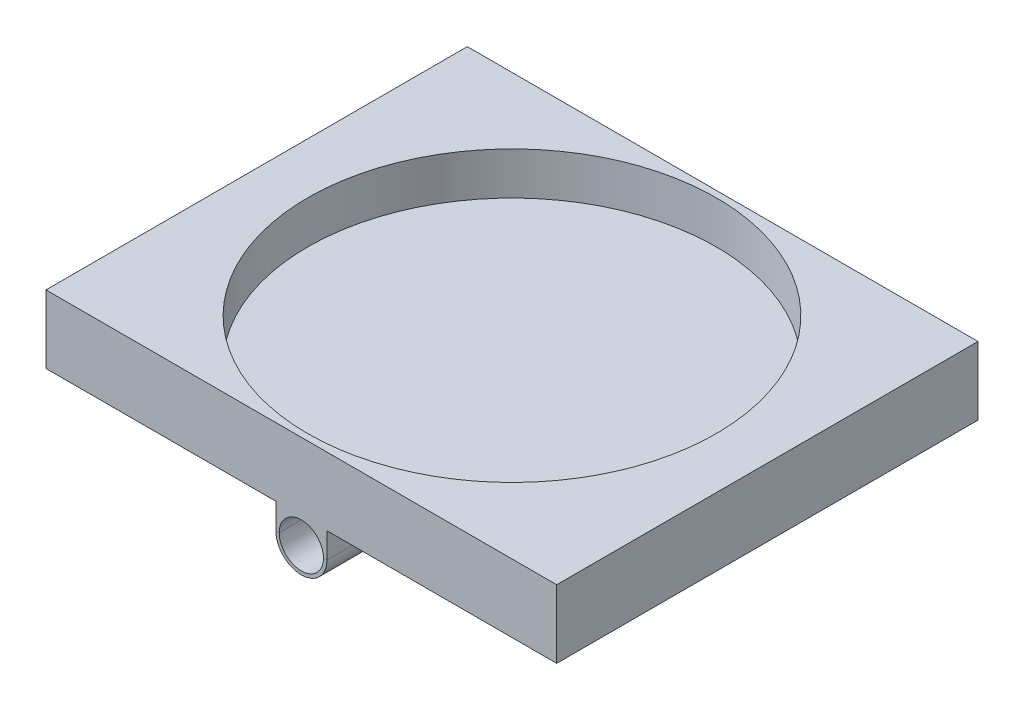
from build123d import *

# Parameters (mm, degrees)
SKETCH2_R           = 3
BOSS_EXTRUDE1_DEPTH = 49.5
SKETCH4_R           = 2.6
CUT_EXTRUDE1_DEPTH  = 49.5
SKETCH5_W           = 18.579549567
SKETCH5_H           = 4.34209906
CUT_EXTRUDE2_DEPTH  = 49.5
BOSS_EXTRUDE2_DEPTH = 49.5
SKETCH6_R           = 24
CUT_EXTRUDE3_DEPTH  = 5
SKETCH9_R           = 1
CUT_EXTRUDE5_DEPTH  = 10


with BuildPart() as part:
    # Sketch2 → Boss-Extrude1 (new body)
    with BuildSketch(Plane.XY):
        Circle(SKETCH2_R)
    extrude(amount=BOSS_EXTRUDE1_DEPTH)

    # Sketch4 → Cut-Extrude1 (cut)
    with BuildSketch(Plane.XY.offset(49.5)):
        Circle(SKETCH4_R)
    extrude(amount=-CUT_EXTRUDE1_DEPTH, mode=Mode.SUBTRACT)

    # Sketch5 → Cut-Extrude2 (cut)
    with BuildSketch(Plane.XY.offset(49.5)):
        with Locations((3.844372333, 2.17104953)):
            Rectangle(SKETCH5_W, SKETCH5_H)
    extrude(amount=-CUT_EXTRUDE2_DEPTH, mode=Mode.SUBTRACT)


with BuildPart() as body_2:
    # Sketch3 → Boss-Extrude2 (new body)
    with BuildSketch(Plane.XY.offset(49.5)):
        with BuildLine():
            Line((3, 0), (3, 3))
            Line((3, 3), (30, 3))
            Line((30, 3), (30, 11))
            Line((30, 11), (-30, 11))
            Line((-30, 11), (-30, 3))
            Line((-30, 3), (-3, 3))
            Line((-3, 3), (-3, 0))
            Line((-3, 0), (-2.6, 0))
            ThreePointArc((-2.6, 0), (0, 2.6), (2.6, 0))
            Line((2.6, 0), (3, 0))
        make_face()
    extrude(amount=-BOSS_EXTRUDE2_DEPTH)

    # Sketch6 → Cut-Extrude3 (cut)
    with BuildSketch(Plane(origin=(0, 11, 0), x_dir=(1, 0, 0), z_dir=(0, 1, 0))):
        with Locations(Location((0, -24.75, 0), (0, 0, 270))):
            Circle(SKETCH6_R)
    extrude(amount=-CUT_EXTRUDE3_DEPTH, mode=Mode.SUBTRACT)


with BuildPart() as cut_extrude5_tool:
    # Sketch9 → Cut-Extrude5 (new body)
    with BuildSketch(Plane(origin=(3, 0, 0), x_dir=(0, 0, -1), z_dir=(1, 0, 0))):
        with Locations((-24.75, 0)):
            Circle(SKETCH9_R)
    extrude(amount=-CUT_EXTRUDE5_DEPTH)


with BuildPart() as part_1:
    add(part.part)

    # Cut-Extrude5: cut by cut_extrude5_tool
    add(cut_extrude5_tool.part, mode=Mode.SUBTRACT)


with BuildPart() as body_2_1:
    add(body_2.part)

    # Cut-Extrude5: cut by cut_extrude5_tool
    add(cut_extrude5_tool.part, mode=Mode.SUBTRACT)


solid = Compound([part_1.part, body_2_1.part])
